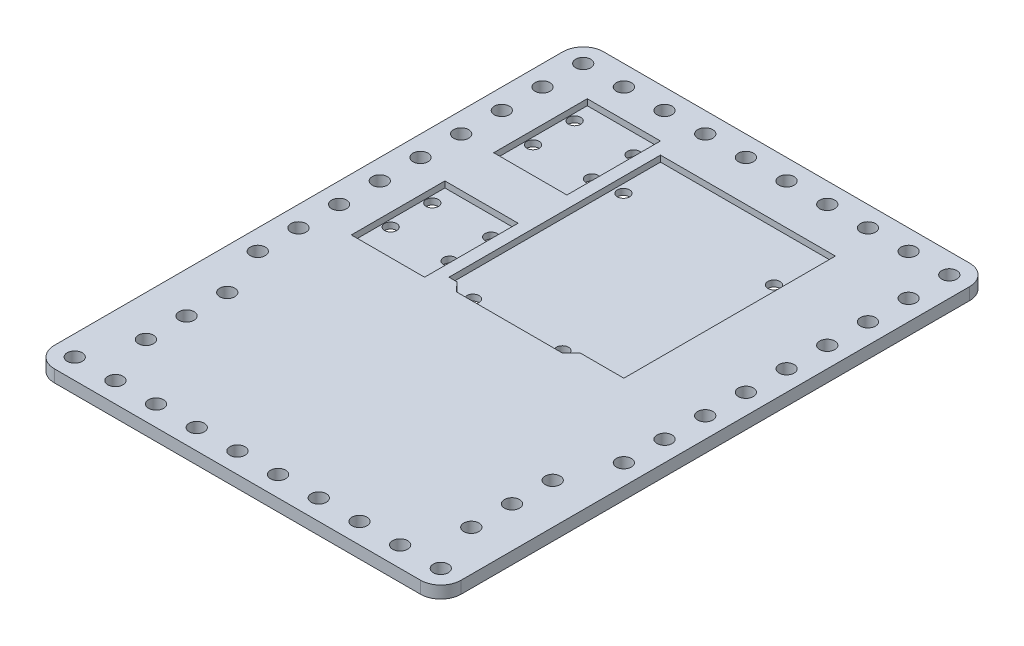
from build123d import *

# Parameters (mm, degrees)
PLATE_EXTRUDE_DEPTH               = 3.81
SKETCH2_R                         = 2.3495
OUTER_HOLE_CUT_DEPTH              = 214.397794272
SKETCH3_R                         = 1.905
ARDUINO_SHAPE_CUT_DEPTH           = 1.905
SKETCH4_W                         = 22.86
SKETCH4_H                         = 29.21
SKETCH4_R                         = 1.905
HG7881_CUT_DEPTH                  = 1.905
SKETCH5_R                         = 1.905
ARDUINO_AND_HG7881_HOLE_CUT_DEPTH = 214.397794272


with BuildPart() as part:
    # Sketch1 → Plate Extrude (new body)
    with BuildSketch(Plane(origin=(0, 0, 0), x_dir=(1, 0, 0), z_dir=(0, 1, 0))):
        with BuildLine():
            Line((6.35, 0), (120.65, 0))
            ThreePointArc((120.65, 0), (125.140128061, 1.859871939), (127, 6.35))
            Line((127, 6.35), (127, 165.1))
            ThreePointArc((127, 165.1), (125.140128061, 169.590128061), (120.65, 171.45))
            Line((120.65, 171.45), (6.35, 171.45))
            ThreePointArc((6.35, 171.45), (1.859871939, 169.590128061), (0, 165.1))
            Line((0, 165.1), (0, 6.35))
            ThreePointArc((0, 6.35), (1.859871939, 1.859871939), (6.35, 0))
        make_face()
    extrude(amount=PLATE_EXTRUDE_DEPTH)

    # Sketch2 → Outer Hole Cut (cut, through all)
    with BuildSketch(Plane(origin=(0, 3.81, 0), x_dir=(1, 0, 0), z_dir=(0, 1, 0))):
        with Locations(Location((6.35, 165.1, 0), (0, 0, 270))):
            Circle(SKETCH2_R)
        with Locations(Location((19.05, 165.1, 0), (0, 0, 270))):
            Circle(SKETCH2_R)
        with Locations(Location((31.75, 165.1, 0), (0, 0, 270))):
            Circle(SKETCH2_R)
        with Locations(Location((44.45, 165.1, 0), (0, 0, 270))):
            Circle(SKETCH2_R)
        with Locations(Location((57.15, 165.1, 0), (0, 0, 270))):
            Circle(SKETCH2_R)
        with Locations(Location((69.85, 165.1, 0), (0, 0, 270))):
            Circle(SKETCH2_R)
        with Locations(Location((82.55, 165.1, 0), (0, 0, 270))):
            Circle(SKETCH2_R)
        with Locations(Location((95.25, 165.1, 0), (0, 0, 270))):
            Circle(SKETCH2_R)
        with Locations(Location((107.95, 165.1, 0), (0, 0, 270))):
            Circle(SKETCH2_R)
        with Locations(Location((120.65, 165.1, 0), (0, 0, 270))):
            Circle(SKETCH2_R)
        with Locations(Location((6.35, 152.4, 0), (0, 0, 270))):
            Circle(SKETCH2_R)
        with Locations(Location((120.65, 152.4, 0), (0, 0, 270))):
            Circle(SKETCH2_R)
        with Locations(Location((6.35, 139.7, 0), (0, 0, 270))):
            Circle(SKETCH2_R)
        with Locations(Location((120.65, 139.7, 0), (0, 0, 270))):
            Circle(SKETCH2_R)
        with Locations(Location((6.35, 127, 0), (0, 0, 270))):
            Circle(SKETCH2_R)
        with Locations(Location((120.65, 127, 0), (0, 0, 270))):
            Circle(SKETCH2_R)
        with Locations(Location((6.35, 114.3, 0), (0, 0, 270))):
            Circle(SKETCH2_R)
        with Locations(Location((120.65, 114.3, 0), (0, 0, 270))):
            Circle(SKETCH2_R)
        with Locations(Location((6.35, 101.6, 0), (0, 0, 270))):
            Circle(SKETCH2_R)
        with Locations(Location((120.65, 101.6, 0), (0, 0, 270))):
            Circle(SKETCH2_R)
        with Locations(Location((6.35, 88.9, 0), (0, 0, 270))):
            Circle(SKETCH2_R)
        with Locations(Location((120.65, 88.9, 0), (0, 0, 270))):
            Circle(SKETCH2_R)
        with Locations(Location((6.35, 76.2, 0), (0, 0, 270))):
            Circle(SKETCH2_R)
        with Locations(Location((120.65, 76.2, 0), (0, 0, 270))):
            Circle(SKETCH2_R)
        with Locations(Location((6.35, 63.5, 0), (0, 0, 270))):
            Circle(SKETCH2_R)
        with Locations(Location((120.65, 63.5, 0), (0, 0, 270))):
            Circle(SKETCH2_R)
        with Locations(Location((6.35, 6.35, 0), (0, 0, 270))):
            Circle(SKETCH2_R)
        with Locations(Location((19.05, 6.35, 0), (0, 0, 270))):
            Circle(SKETCH2_R)
        with Locations(Location((31.75, 6.35, 0), (0, 0, 270))):
            Circle(SKETCH2_R)
        with Locations(Location((44.45, 6.35, 0), (0, 0, 270))):
            Circle(SKETCH2_R)
        with Locations(Location((57.15, 6.35, 0), (0, 0, 270))):
            Circle(SKETCH2_R)
        with Locations(Location((69.85, 6.35, 0), (0, 0, 270))):
            Circle(SKETCH2_R)
        with Locations(Location((82.55, 6.35, 0), (0, 0, 270))):
            Circle(SKETCH2_R)
        with Locations(Location((95.25, 6.35, 0), (0, 0, 270))):
            Circle(SKETCH2_R)
        with Locations(Location((107.95, 6.35, 0), (0, 0, 270))):
            Circle(SKETCH2_R)
        with Locations(Location((120.65, 6.35, 0), (0, 0, 270))):
            Circle(SKETCH2_R)
        with Locations(Location((12.7, 22.225, 0), (0, 0, 270))):
            Circle(SKETCH2_R)
        with Locations(Location((12.7, 34.925, 0), (0, 0, 270))):
            Circle(SKETCH2_R)
        with Locations(Location((12.7, 47.625, 0), (0, 0, 270))):
            Circle(SKETCH2_R)
        with Locations(Location((114.3, 47.625, 0), (0, 0, 270))):
            Circle(SKETCH2_R)
        with Locations(Location((114.3, 34.925, 0), (0, 0, 270))):
            Circle(SKETCH2_R)
        with Locations(Location((114.3, 22.225, 0), (0, 0, 270))):
            Circle(SKETCH2_R)
    extrude(amount=-OUTER_HOLE_CUT_DEPTH, mode=Mode.SUBTRACT)

    # Sketch3 → Arduino Shape Cut (cut)
    with BuildSketch(Plane(origin=(0, 3.81, 0), x_dir=(1, 0, 0), z_dir=(0, 1, 0))):
        Polygon((48.26, 83.566), (81.28, 83.566), (84.074, 86.36), (97.79, 86.36), (97.79, 152.4), (43.18, 152.4), (43.18, 86.36), (45.72, 86.36), align=None)
        with Locations(Location((50.927, 86.106, 0), (0, 0, 270))):
            Circle(SKETCH3_R, mode=Mode.SUBTRACT)
        with Locations(Location((78.867, 86.106, 0), (0, 0, 270))):
            Circle(SKETCH3_R, mode=Mode.SUBTRACT)
        with Locations(Location((45.847, 138.176, 0), (0, 0, 270))):
            Circle(SKETCH3_R, mode=Mode.SUBTRACT)
        with Locations(Location((94.107, 136.906, 0), (0, 0, 270))):
            Circle(SKETCH3_R, mode=Mode.SUBTRACT)
    extrude(amount=-ARDUINO_SHAPE_CUT_DEPTH, mode=Mode.SUBTRACT)

    # Sketch4 → HG7881 Cut (cut)
    # profile 1 of 2: a face of its own
    with BuildSketch(Plane(origin=(0, 3.81, 0), x_dir=(1, 0, 0), z_dir=(0, 1, 0))):
        with Locations((27.94, 141.605)):
            Rectangle(SKETCH4_W, SKETCH4_H)
        with Locations(Location((37.004970647, 137.183397888, 0), (0, 0, 270))):
            Circle(SKETCH4_R, mode=Mode.SUBTRACT)
        with Locations(Location((37.004970647, 150.182885458, 0), (0, 0, 270))):
            Circle(SKETCH4_R, mode=Mode.SUBTRACT)
        with Locations(Location((18.605695933, 150.182885458, 0), (0, 0, 270))):
            Circle(SKETCH4_R, mode=Mode.SUBTRACT)
        with Locations(Location((18.605695933, 137.183397888, 0), (0, 0, 270))):
            Circle(SKETCH4_R, mode=Mode.SUBTRACT)
    # profile 2 of 2: a face of its own
    with BuildSketch(Plane(origin=(0, 3.81, 0), x_dir=(1, 0, 0), z_dir=(0, 1, 0))):
        with Locations((27.94, 97.155)):
            Rectangle(SKETCH4_W, SKETCH4_H)
        with Locations(Location((37.004970647, 92.733397888, 0), (0, 0, 270))):
            Circle(SKETCH4_R, mode=Mode.SUBTRACT)
        with Locations(Location((37.004970647, 105.732885458, 0), (0, 0, 270))):
            Circle(SKETCH4_R, mode=Mode.SUBTRACT)
        with Locations(Location((18.605695933, 105.732885458, 0), (0, 0, 270))):
            Circle(SKETCH4_R, mode=Mode.SUBTRACT)
        with Locations(Location((18.605695933, 92.733397888, 0), (0, 0, 270))):
            Circle(SKETCH4_R, mode=Mode.SUBTRACT)
    extrude(amount=-HG7881_CUT_DEPTH, mode=Mode.SUBTRACT)

    # Sketch5 → Arduino and HG7881 Hole Cut (cut, through all)
    with BuildSketch(Plane(origin=(0, 3.81, 0), x_dir=(1, 0, 0), z_dir=(0, 1, 0))):
        with Locations(Location((94.107, 136.906, 0), (0, 0, 270))):
            Circle(SKETCH5_R)
        with Locations(Location((78.867, 86.106, 0), (0, 0, 270))):
            Circle(SKETCH5_R)
        with Locations(Location((50.927, 86.106, 0), (0, 0, 270))):
            Circle(SKETCH5_R)
        with Locations(Location((45.847, 138.176, 0), (0, 0, 270))):
            Circle(SKETCH5_R)
        with Locations(Location((18.605695933, 150.182885458, 0), (0, 0, 270))):
            Circle(SKETCH5_R)
        with Locations(Location((37.004970647, 150.182885458, 0), (0, 0, 270))):
            Circle(SKETCH5_R)
        with Locations(Location((37.004970647, 137.183397888, 0), (0, 0, 270))):
            Circle(SKETCH5_R)
        with Locations(Location((18.605695933, 137.183397888, 0), (0, 0, 270))):
            Circle(SKETCH5_R)
        with Locations(Location((18.605695933, 105.732885458, 0), (0, 0, 270))):
            Circle(SKETCH5_R)
        with Locations(Location((18.605695933, 92.733397888, 0), (0, 0, 270))):
            Circle(SKETCH5_R)
        with Locations(Location((37.004970647, 92.733397888, 0), (0, 0, 270))):
            Circle(SKETCH5_R)
        with Locations(Location((37.004970647, 105.732885458, 0), (0, 0, 270))):
            Circle(SKETCH5_R)
    extrude(amount=-ARDUINO_AND_HG7881_HOLE_CUT_DEPTH, mode=Mode.SUBTRACT)


solid = part.part
